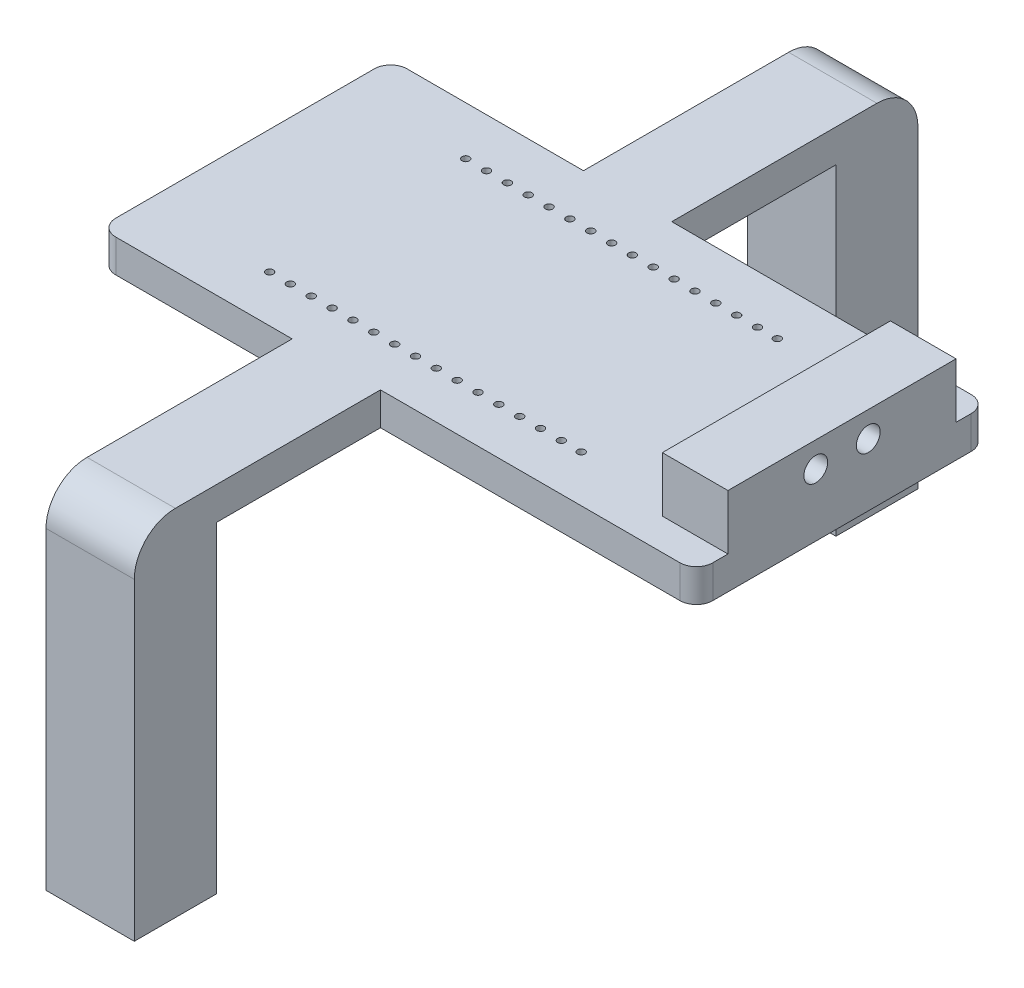
from build123d import *

# Parameters (mm, degrees)
SKETCH1_W           = 72.75
SKETCH1_H           = 35.5
BOSS_EXTRUDE1_DEPTH = 2
SKETCH7_W           = 10.759451316
SKETCH7_H           = 30
BOSS_EXTRUDE4_DEPTH = 4
SKETCH10_W          = 10.759451316
SKETCH10_H          = 10
BOSS_EXTRUDE5_DEPTH = 43.2
FILLET2_R           = 5
SKETCH12_W          = 72.75
SKETCH12_H          = 35.5
BOSS_EXTRUDE6_DEPTH = 2
FILLET4_R           = 2
SKETCH16_W          = 27.8
SKETCH16_H          = 6.7
BOSS_EXTRUDE8_DEPTH = 8
SKETCH19_R          = 1.45
CUT_EXTRUDE2_DEPTH  = 4
SKETCH20_R          = 0.45
CUT_EXTRUDE3_DEPTH  = 102.358708347
SKETCH21_R          = 3.1
CUT_EXTRUDE4_DEPTH  = 5


with BuildPart() as part:
    # Sketch1 → Boss-Extrude1 (new body)
    with BuildSketch(Plane(origin=(0, 0, 0), x_dir=(1, 0, 0), z_dir=(0, 1, 0))):
        with Locations((30.829669563, 14.626919984)):
            Rectangle(SKETCH1_W, SKETCH1_H)
    extrude(amount=BOSS_EXTRUDE1_DEPTH)

    # Sketch7 → Boss-Extrude4 (add)
    with BuildSketch(Plane(origin=(0, 2, 0), x_dir=(1, 0, 0), z_dir=(0, 1, 0))):
        with Locations((23.329669563, 47.376919984)):
            Rectangle(SKETCH7_W, SKETCH7_H)
    boss_extrude4 = extrude(amount=-BOSS_EXTRUDE4_DEPTH)

    # Mirror3: Boss-Extrude4 across plane
    add(boss_extrude4.mirror(Plane.XY.offset(-14.626919984)))

    # Sketch10 → Boss-Extrude5 (add)
    with BuildSketch(Plane(origin=(0, 2, 0), x_dir=(1, 0, 0), z_dir=(0, 1, 0))):
        with Locations((23.329669563, 57.376919984)):
            Rectangle(SKETCH10_W, SKETCH10_H)
    boss_extrude5 = extrude(amount=-BOSS_EXTRUDE5_DEPTH)

    # Mirror4: Boss-Extrude5 across plane
    add(boss_extrude5.mirror(Plane.XY.offset(-14.626919984)))

    # Fillet2
    fillet2_edges = [part.edges().sort_by_distance(p)[0] for p in [
        (23.329669563, 2, -62.376919984),
        (23.329669563, 2, 33.123080016),
    ]]
    fillet(fillet2_edges, radius=FILLET2_R)

    # Sketch12 → Boss-Extrude6 (add)
    with BuildSketch(Plane.XZ):
        with Locations((30.829669563, -14.626919984)):
            Rectangle(SKETCH12_W, SKETCH12_H)
    extrude(amount=BOSS_EXTRUDE6_DEPTH)

    # Fillet4
    fillet4_edges = [part.edges().sort_by_distance(p)[0] for p in [
        (67.204669563, 0, 3.123080016),
        (-5.545330437, 0, 3.123080016),
        (-5.545330437, 0, -32.376919984),
        (67.204669563, 0, -32.376919984),
    ]]
    fillet(fillet4_edges, radius=FILLET4_R)

    # Sketch16 → Boss-Extrude8 (add)
    with BuildSketch(Plane(origin=(67.204669563, 0, 0), x_dir=(0, 0, -1), z_dir=(1, 0, 0))):
        with Locations((14.626919984, 5.35)):
            Rectangle(SKETCH16_W, SKETCH16_H)
    extrude(amount=-BOSS_EXTRUDE8_DEPTH)

    # Sketch19 → Cut-Extrude2 (cut)
    with BuildSketch(Plane(origin=(67.204669563, 0, 0), x_dir=(0, 0, -1), z_dir=(1, 0, 0))):
        with Locations((17.826919984, 5.611929266)):
            Circle(SKETCH19_R)
        with Locations((11.426919984, 5.611929266)):
            Circle(SKETCH19_R)
    extrude(amount=-CUT_EXTRUDE2_DEPTH, mode=Mode.SUBTRACT)

    # Sketch20 → Cut-Extrude3 (cut, through all)
    with BuildSketch(Plane(origin=(0, 2, 0), x_dir=(1, 0, 0), z_dir=(0, 1, 0))):
        with Locations(Location((9.510831856, 26.461370287, 0), (0, 0, 270))):
            Circle(SKETCH20_R)
        with Locations(Location((12.050831856, 26.461370287, 0), (0, 0, 270))):
            Circle(SKETCH20_R)
        with Locations(Location((17.130831856, 26.461370287, 0), (0, 0, 270))):
            Circle(SKETCH20_R)
        with Locations(Location((47.485831856, 26.461370287, 0), (0, 0, 270))):
            Circle(SKETCH20_R)
        with Locations(Location((45.070831856, 26.461370287, 0), (0, 0, 270))):
            Circle(SKETCH20_R)
        with Locations(Location((37.450831856, 26.461370287, 0), (0, 0, 270))):
            Circle(SKETCH20_R)
        with Locations(Location((29.830831856, 26.461370287, 0), (0, 0, 270))):
            Circle(SKETCH20_R)
        with Locations(Location((14.590831856, 26.461370287, 0), (0, 0, 270))):
            Circle(SKETCH20_R)
        with Locations(Location((42.530831856, 26.461370287, 0), (0, 0, 270))):
            Circle(SKETCH20_R)
        with Locations(Location((39.990831856, 26.461370287, 0), (0, 0, 270))):
            Circle(SKETCH20_R)
        with Locations(Location((34.910831856, 26.461370287, 0), (0, 0, 270))):
            Circle(SKETCH20_R)
        with Locations(Location((32.370831856, 26.461370287, 0), (0, 0, 270))):
            Circle(SKETCH20_R)
        with Locations(Location((27.290831856, 26.461370287, 0), (0, 0, 270))):
            Circle(SKETCH20_R)
        with Locations(Location((24.750831856, 26.461370287, 0), (0, 0, 270))):
            Circle(SKETCH20_R)
        with Locations(Location((22.210831856, 26.461370287, 0), (0, 0, 270))):
            Circle(SKETCH20_R)
        with Locations(Location((19.670831856, 26.461370287, 0), (0, 0, 270))):
            Circle(SKETCH20_R)
        with Locations(Location((9.510831856, 2.561370287, 0), (0, 0, 90))):
            Circle(SKETCH20_R)
        with Locations(Location((12.050831856, 2.561370287, 0), (0, 0, 90))):
            Circle(SKETCH20_R)
        with Locations(Location((14.590831856, 2.561370287, 0), (0, 0, 90))):
            Circle(SKETCH20_R)
        with Locations(Location((17.130831856, 2.561370287, 0), (0, 0, 90))):
            Circle(SKETCH20_R)
        with Locations(Location((19.670831856, 2.561370287, 0), (0, 0, 90))):
            Circle(SKETCH20_R)
        with Locations(Location((22.210831856, 2.561370287, 0), (0, 0, 90))):
            Circle(SKETCH20_R)
        with Locations(Location((24.750831856, 2.561370287, 0), (0, 0, 90))):
            Circle(SKETCH20_R)
        with Locations(Location((29.830831856, 2.561370287, 0), (0, 0, 90))):
            Circle(SKETCH20_R)
        with Locations(Location((32.370831856, 2.561370287, 0), (0, 0, 90))):
            Circle(SKETCH20_R)
        with Locations(Location((34.910831856, 2.561370287, 0), (0, 0, 90))):
            Circle(SKETCH20_R)
        with Locations(Location((27.290831856, 2.561370287, 0), (0, 0, 90))):
            Circle(SKETCH20_R)
        with Locations(Location((39.990831856, 2.561370287, 0), (0, 0, 90))):
            Circle(SKETCH20_R)
        with Locations(Location((37.450831856, 2.561370287, 0), (0, 0, 90))):
            Circle(SKETCH20_R)
        with Locations(Location((42.530831856, 2.561370287, 0), (0, 0, 90))):
            Circle(SKETCH20_R)
        with Locations(Location((47.485831856, 2.561370287, 0), (0, 0, 90))):
            Circle(SKETCH20_R)
        with Locations(Location((45.070831856, 2.561370287, 0), (0, 0, 90))):
            Circle(SKETCH20_R)
    extrude(amount=-CUT_EXTRUDE3_DEPTH, mode=Mode.SUBTRACT)

    # Sketch21 → Cut-Extrude4 (cut)
    with BuildSketch(Plane.XZ.offset(41.2)):
        with Locations(Location((23.329669563, 28.123080016, 0), (0, 0, 270))):
            Circle(SKETCH21_R)
    cut_extrude4 = extrude(amount=-CUT_EXTRUDE4_DEPTH, mode=Mode.SUBTRACT)

    # Mirror5: Cut-Extrude4 across plane
    add(cut_extrude4.mirror(Plane.XY.offset(-14.626919984)), mode=Mode.SUBTRACT)


solid = part.part
